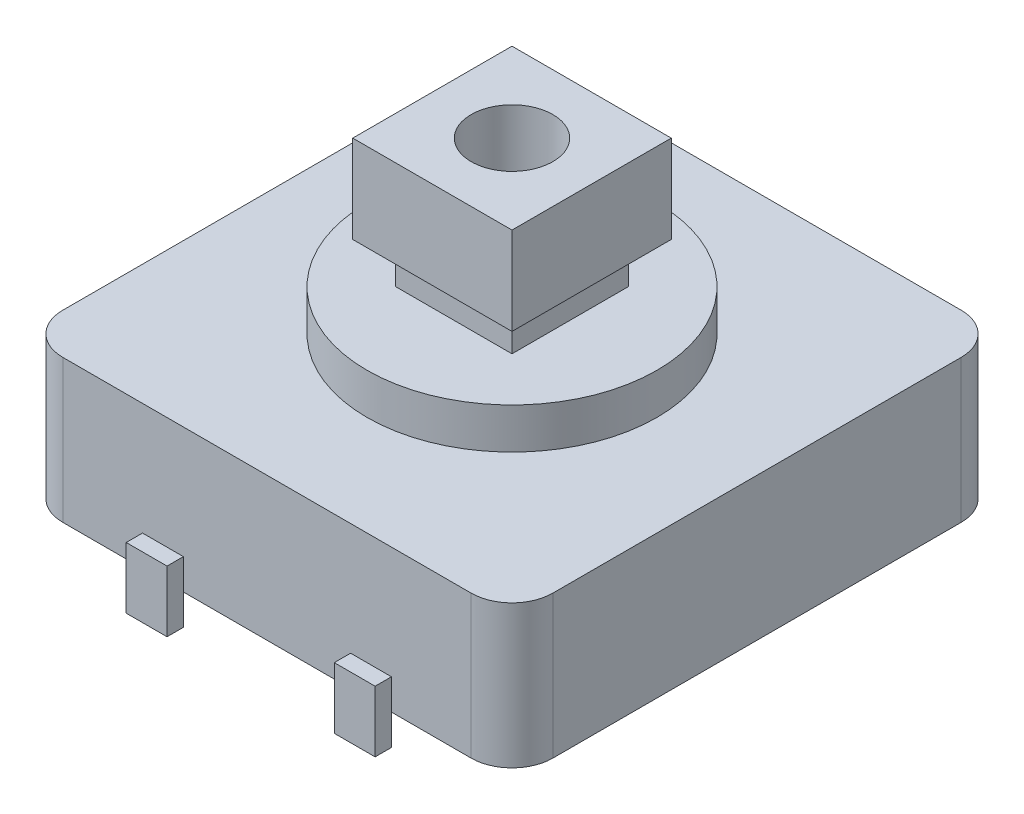
from build123d import *

# Parameters (mm, degrees)
BOSS_EXTRUDE1_DEPTH = 3.5
SKETCH2_R           = 3.55
BOSS_EXTRUDE2_DEPTH = 1
SKETCH3_W           = 2.85
SKETCH3_H           = 2.85
BOSS_EXTRUDE3_DEPTH = 1
SKETCH4_W           = 3.9
SKETCH4_H           = 3.9
SKETCH4_R           = 1
BOSS_EXTRUDE4_DEPTH = 2.15
SKETCH5_W           = 1
SKETCH5_H           = 1.5
BOSS_EXTRUDE5_DEPTH = 0.4


with BuildPart() as part:
    # Sketch1 → Boss-Extrude1 (new body)
    with BuildSketch(Plane(origin=(0, 0, 0), x_dir=(1, 0, 0), z_dir=(0, 1, 0))):
        with BuildLine():
            Line((-5, -6), (5, -6))
            ThreePointArc((5, -6), (5.707106781, -5.707106781), (6, -5))
            Line((6, -5), (6, 5))
            ThreePointArc((6, 5), (5.707106781, 5.707106781), (5, 6))
            Line((5, 6), (-5, 6))
            ThreePointArc((-5, 6), (-5.707106781, 5.707106781), (-6, 5))
            Line((-6, 5), (-6, -5))
            ThreePointArc((-6, -5), (-5.707106781, -5.707106781), (-5, -6))
        make_face()
    extrude(amount=BOSS_EXTRUDE1_DEPTH)

    # Sketch2 → Boss-Extrude2 (add)
    with BuildSketch(Plane(origin=(0, 3.5, 0), x_dir=(1, 0, 0), z_dir=(0, 1, 0))):
        with Locations(Location((0, 0, 0), (0, 0, 270))):
            Circle(SKETCH2_R)
    extrude(amount=BOSS_EXTRUDE2_DEPTH)

    # Sketch3 → Boss-Extrude3 (add)
    with BuildSketch(Plane(origin=(0, 4.5, 0), x_dir=(1, 0, 0), z_dir=(0, 1, 0))):
        Rectangle(SKETCH3_W, SKETCH3_H)
    extrude(amount=BOSS_EXTRUDE3_DEPTH)

    # Sketch4 → Boss-Extrude4 (add)
    with BuildSketch(Plane(origin=(0, 5.5, 0), x_dir=(1, 0, 0), z_dir=(0, 1, 0))):
        Rectangle(SKETCH4_W, SKETCH4_H)
        with Locations(Location((0, 0, 0), (0, 0, 90))):
            Circle(SKETCH4_R, mode=Mode.SUBTRACT)
    extrude(amount=BOSS_EXTRUDE4_DEPTH)

    # Sketch5 → Boss-Extrude5 (add)
    with BuildSketch(Plane.XY.offset(6)):
        with Locations((-2.547676789, 0)):
            Rectangle(SKETCH5_W, SKETCH5_H)
        with Locations((2.547676789, 0)):
            Rectangle(SKETCH5_W, SKETCH5_H)
    boss_extrude5 = extrude(amount=BOSS_EXTRUDE5_DEPTH)

    # Mirror1: Boss-Extrude5 across plane
    add(boss_extrude5.mirror(Plane.XY))


solid = part.part
